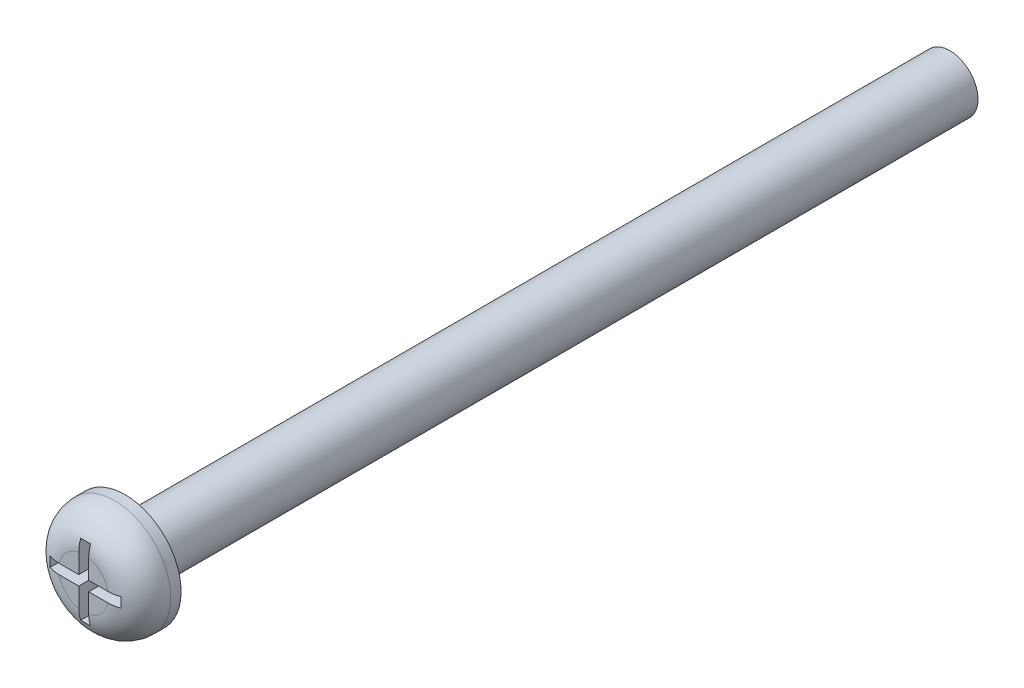
from build123d import *

# Parameters (mm, degrees)
SKETCH1_R           = 1.7272
BOSS_EXTRUDE1_DEPTH = 50.546
SKETCH2_R           = 3.429
BOSS_EXTRUDE2_DEPTH = 2.54
FILLET1_R           = 1.905
CUT_EXTRUDE1_DEPTH  = 1.905


with BuildPart() as part:
    # Sketch1 → Boss-Extrude1 (new body)
    with BuildSketch(Plane.XY):
        Circle(SKETCH1_R)
    extrude(amount=BOSS_EXTRUDE1_DEPTH)

    # Sketch2 → Boss-Extrude2 (add)
    with BuildSketch(Plane.XY.offset(50.546)):
        Circle(SKETCH2_R)
    extrude(amount=BOSS_EXTRUDE2_DEPTH)

    # Fillet1
    fillet1_edges = [part.edges().sort_by_distance(p)[0] for p in [
        (-3.429, 0, 53.086),
    ]]
    fillet(fillet1_edges, radius=FILLET1_R)

    # Sketch3 → Cut-Extrude1 (cut)
    with BuildSketch(Plane.XY.offset(53.086)):
        Polygon((-0.303567799, 0.303567799), (-0.303567799, 2.17637078), (0.303567799, 2.17637078), (0.303567799, 0.303567799), (2.17637078, 0.303567799), (2.17637078, -0.303567799), (0.303567799, -0.303567799), (0.303567799, -2.17637078), (-0.303567799, -2.17637078), (-0.303567799, -0.303567799), (-2.17637078, -0.303567799), (-2.17637078, 0.303567799), align=None)
    extrude(amount=-CUT_EXTRUDE1_DEPTH, mode=Mode.SUBTRACT)


solid = part.part
